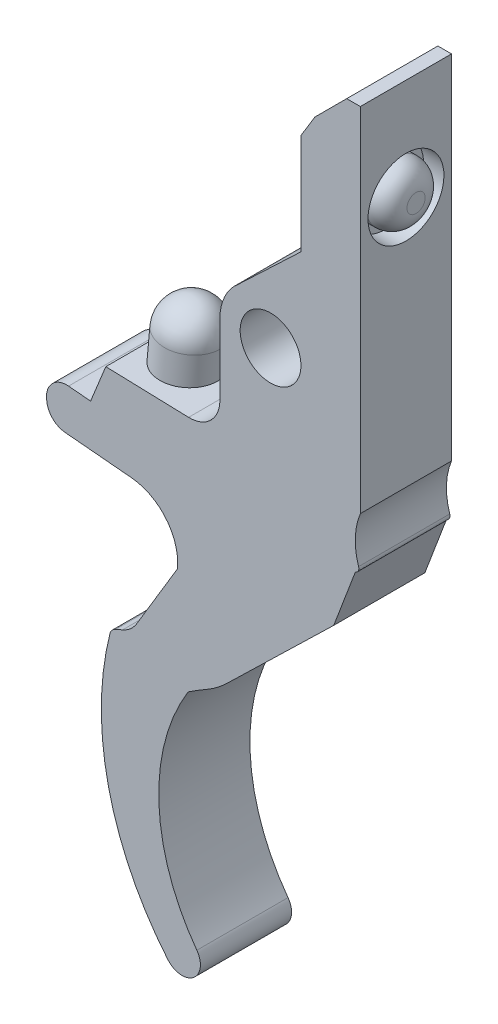
from build123d import *

# Parameters (mm, degrees)
SKETCH_1_R          = 5
SKETCH_1_R_2        = 3
EXTRUDE_1_DEPTH     = 9
SKETCH_2_R          = 3.75
CUT_EXTRUDE_1_DEPTH = 2
SKETCH_3_R          = 2.9
EXTRUDE_2_DEPTH     = 3
FILLET_1_R          = 2
SKETCH_4_R          = 2.9
EXTRUDE_3_DEPTH     = 10
FILLET_2_R          = 2.9
FILLET_3_R          = 3


with BuildPart() as part:
    # 스케치1 → 보스-돌출1 (new body)
    # profile 1 of 5: a face of its own
    with BuildSketch(Plane.XY):
        with BuildLine():
            Line((8.866410343, 21.94338903), (4.384187039, 21.94338903))
            Line((4.384187039, 21.94338903), (2.987768149, 19.65002342))
            Line((2.987768149, 19.65002342), (2.987768149, 17.661246793))
            Line((2.987768149, 17.661246793), (2.987768149, 9.70876495))
            Line((2.987768149, 9.70876495), (-3.184671245, 3.854590647))
            ThreePointArc((-3.184671245, 3.854590647), (2.13033375, 4.523458645), (5, 0))
            ThreePointArc((5, 0), (0, -5), (-5, 0))
            Line((-5, 0), (-5, -10.071407464))
            Line((-5, -10.071407464), (-16.264805165, -9.728236855))
            Line((-16.264805165, -9.728236855), (-17.766639728, -13.42657959))
            Line((-17.766639728, -13.42657959), (-19.940502755, -13.22881584))
            ThreePointArc((-19.940502755, -13.22881584), (-21.568981751, -13.840235901), (-22.102673306, -15.49581787))
            ThreePointArc((-22.102673306, -15.49581787), (-21.54079944, -16.765444299), (-20.287735083, -17.363343312))
            Line((-20.287735083, -17.363343312), (-13.716958703, -17.9611093))
            ThreePointArc((-13.716958703, -17.9611093), (-10.295562947, -19.77999502), (-9.201017746, -23.497018692))
            Line((-9.201017746, -23.497018692), (-13.218080179, -30.193463728))
            ThreePointArc((-13.218080179, -30.193463728), (-13.817495958, -30.9099569), (-14.608237914, -31.407338947))
            Line((-14.608237914, -31.407338947), (-15.296022277, -31.702310231))
            ThreePointArc((-15.296022277, -31.702310231), (-15.622210934, -31.927735325), (-15.835150792, -32.262208238))
            ThreePointArc((-15.835150792, -32.262208238), (-16.003126851, -45.501568691), (-10.133257231, -57.36974091))
            ThreePointArc((-10.133257231, -57.36974091), (-7.618845179, -57.635707988), (-7.276099317, -55.130606848))
            ThreePointArc((-7.276099317, -55.130606848), (-11.022489697, -44.432594757), (-8.133553397, -33.471894478))
            ThreePointArc((-8.133553397, -33.471894478), (-7.245000489, -32.901805175), (-6.337557558, -32.362291125))
            ThreePointArc((-6.337557558, -32.362291125), (-5.290911527, -31.673468731), (-4.338619501, -30.85916897))
            Line((-4.338619501, -30.85916897), (6.238088337, -20.600518625))
            Line((6.238088337, -20.600518625), (8.3701186, -14.978169718))
            ThreePointArc((8.3701186, -14.978169718), (8.662275884, -14.729272874), (8.69193724, -14.346616734))
            ThreePointArc((8.69193724, -14.346616734), (8.365752146, -12.021808556), (8.866410343, -9.728236855))
            Line((8.866410343, -9.728236855), (8.866410343, 21.94338903))
        make_face()
    # profile 2 of 5: a face of its own
    with BuildSketch(Plane.XY):
        Circle(SKETCH_1_R)
        Circle(SKETCH_1_R_2, mode=Mode.SUBTRACT)
    # profile 3 of 5: a face of its own
    with BuildSketch(Plane.XY):
        with BuildLine():
            ThreePointArc((5, 0), (2.13033375, 4.523458645), (-3.184671245, 3.854590647))
            ThreePointArc((-3.184671245, 3.854590647), (-4.523458645, 2.13033375), (-5, 0))
            ThreePointArc((-5, 0), (0, -5), (5, 0))
        make_face()
        Circle(SKETCH_1_R_2, mode=Mode.SUBTRACT)
    # profile 4 of 5: a face of its own
    with BuildSketch(Plane.XY):
        Polygon((8.866410343, 25.078081763), (7.518879772, 25.078081763), (4.384187039, 21.94338903), (8.866410343, 21.94338903), align=None)
    # profile 5 of 5: a face of its own
    with BuildSketch(Plane.XY):
        with BuildLine():
            Line((8.866410343, 21.94338903), (4.384187039, 21.94338903))
            Line((4.384187039, 21.94338903), (2.987768149, 19.65002342))
            Line((2.987768149, 19.65002342), (2.987768149, 17.661246793))
            Line((2.987768149, 17.661246793), (2.987768149, 9.70876495))
            Line((2.987768149, 9.70876495), (-3.184671245, 3.854590647))
            ThreePointArc((-3.184671245, 3.854590647), (2.13033375, 4.523458645), (5, 0))
            ThreePointArc((5, 0), (0, -5), (-5, 0))
            Line((-5, 0), (-5, -10.071407464))
            Line((-5, -10.071407464), (-16.264805165, -9.728236855))
            Line((-16.264805165, -9.728236855), (-17.766639728, -13.42657959))
            Line((-17.766639728, -13.42657959), (-19.940502755, -13.22881584))
            ThreePointArc((-19.940502755, -13.22881584), (-21.568981751, -13.840235901), (-22.102673306, -15.49581787))
            ThreePointArc((-22.102673306, -15.49581787), (-21.54079944, -16.765444299), (-20.287735083, -17.363343312))
            Line((-20.287735083, -17.363343312), (-13.716958703, -17.9611093))
            ThreePointArc((-13.716958703, -17.9611093), (-10.295562947, -19.77999502), (-9.201017746, -23.497018692))
            Line((-9.201017746, -23.497018692), (-13.218080179, -30.193463728))
            ThreePointArc((-13.218080179, -30.193463728), (-13.817495958, -30.9099569), (-14.608237914, -31.407338947))
            Line((-14.608237914, -31.407338947), (-15.296022277, -31.702310231))
            ThreePointArc((-15.296022277, -31.702310231), (-15.622210934, -31.927735325), (-15.835150792, -32.262208238))
            ThreePointArc((-15.835150792, -32.262208238), (-16.003126851, -45.501568691), (-10.133257231, -57.36974091))
            ThreePointArc((-10.133257231, -57.36974091), (-7.618845179, -57.635707988), (-7.276099317, -55.130606848))
            ThreePointArc((-7.276099317, -55.130606848), (-11.022489697, -44.432594757), (-8.133553397, -33.471894478))
            ThreePointArc((-8.133553397, -33.471894478), (-7.245000489, -32.901805175), (-6.337557558, -32.362291125))
            ThreePointArc((-6.337557558, -32.362291125), (-5.290911527, -31.673468731), (-4.338619501, -30.85916897))
            Line((-4.338619501, -30.85916897), (6.238088337, -20.600518625))
            Line((6.238088337, -20.600518625), (8.3701186, -14.978169718))
            ThreePointArc((8.3701186, -14.978169718), (8.662275884, -14.729272874), (8.69193724, -14.346616734))
            ThreePointArc((8.69193724, -14.346616734), (8.365752146, -12.021808556), (8.866410343, -9.728236855))
            Line((8.866410343, -9.728236855), (8.866410343, 21.94338903))
        make_face()
    extrude(amount=EXTRUDE_1_DEPTH)

    # 스케치2 → 컷-돌출1 (cut)
    with BuildSketch(Plane(origin=(8.866410343, 0, 0), x_dir=(0, 0, -1), z_dir=(1, 0, 0))):
        with Locations(Location((-4.5, 15.078081763, 0), (0, 0, 90))):
            Circle(SKETCH_2_R)
    extrude(amount=-CUT_EXTRUDE_1_DEPTH, mode=Mode.SUBTRACT)

    # 스케치3 → 보스-돌출2 (add)
    with BuildSketch(Plane(origin=(6.866410343, 0, 0), x_dir=(0, 0, -1), z_dir=(1, 0, 0))):
        with Locations(Location((-4.5, 15.078081763, 0), (0, 0, 90))):
            Circle(SKETCH_3_R)
    extrude(amount=EXTRUDE_2_DEPTH)

    # 필렛1
    fillet_1_edges = [part.edges().sort_by_distance(p)[0] for p in [
        (9.866410343, 12.178081763, 4.5),
    ]]
    fillet(fillet_1_edges, radius=FILLET_1_R)

    # 스케치4 → 보스-돌출3 (add)
    with BuildSketch(Plane(origin=(-1.357268469, -14.919396185, 0), x_dir=(0.995887428286197, -0.09059928355955607, 0), z_dir=(0.09059928355955607, 0.995887428286197, 0))):
        with Locations(Location((-11.65777439, -4.5, 0), (0, 0, 180))):
            Circle(SKETCH_4_R)
    extrude(amount=EXTRUDE_3_DEPTH)

    # 필렛2
    fillet_2_edges = [part.edges().sort_by_distance(p)[0] for p in [
        (-9.173033049, -4.167073817, 4.5),
    ]]
    fillet(fillet_2_edges, radius=FILLET_2_R)

    # 필렛3
    fillet_3_edges = [part.edges().sort_by_distance(p)[0] for p in [
        (-5, -10.071407464, 4.5),
    ]]
    fillet(fillet_3_edges, radius=FILLET_3_R)


solid = part.part
